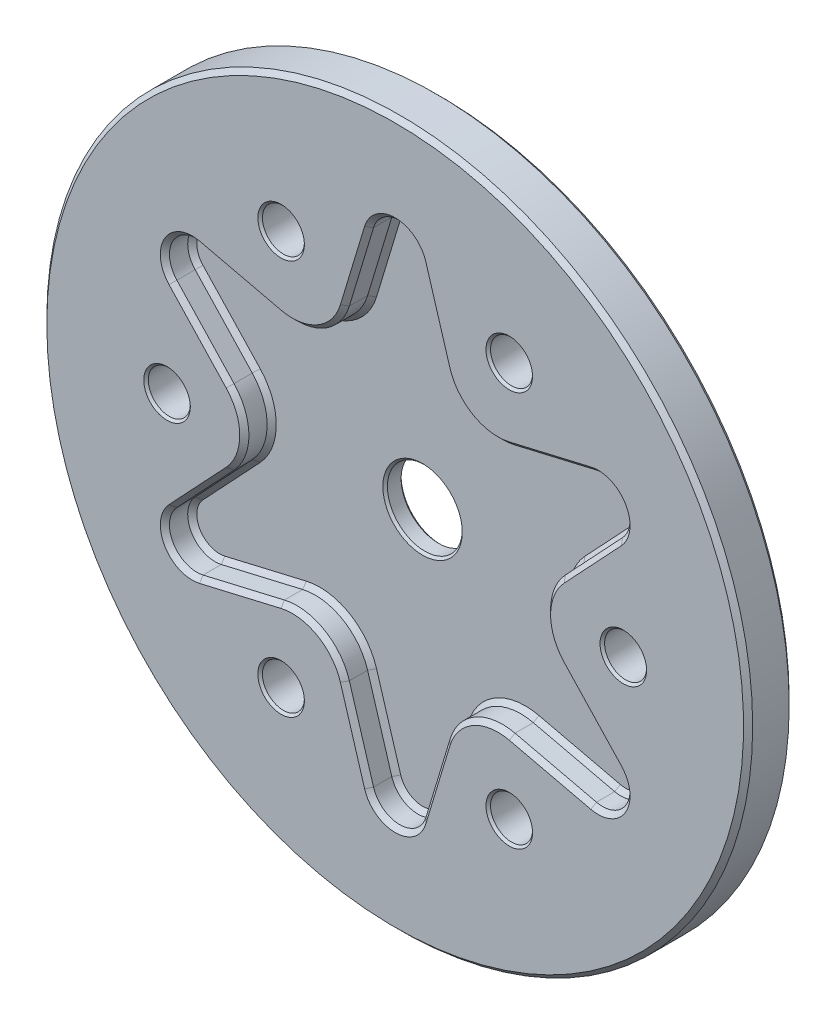
from build123d import *

# Parameters (mm, degrees)
SKETCH1_W           = 38.675
SKETCH1_H           = 5
SKETCH3_R           = 4.1
SKETCH3_R_2         = 2.3
CUT_EXTRUDE4_DEPTH  = 55.92277533
CHAMFER1_SIZE       = 0.5
CUT_EXTRUDE11_DEPTH = 3
CHAMFER2_SIZE       = 0.5
CHAMFER3_SIZE       = 0.25


with BuildPart() as part:
    # Sketch1 → Revolve1 (revolve)
    with BuildSketch(Plane(origin=(0, 0, 0), x_dir=(1, 0, 0), z_dir=(0, 1, 0)), mode=Mode.PRIVATE) as revolve1_sk:
        with Locations((-19.3375, 2.5)):
            Rectangle(SKETCH1_W, SKETCH1_H)
    revolve(revolve1_sk.sketch.rotate(Axis((0, 0, 0), (0, 0, -1)), 180), axis=Axis((0, 0, 0), (0, 0, -1)))

    # Sketch3 → Cut-Extrude4 (cut, through all)
    with BuildSketch(Plane(origin=(0, 0, 0), x_dir=(-1, 0, 0), z_dir=(0, 0, -1))):
        Circle(SKETCH3_R)
        with Locations((-12.5, 21.650635095)):
            Circle(SKETCH3_R_2)
        with Locations((12.5, 21.650635095)):
            Circle(SKETCH3_R_2)
        with Locations((25, 0)):
            Circle(SKETCH3_R_2)
        with Locations((12.5, -21.650635095)):
            Circle(SKETCH3_R_2)
        with Locations((-12.5, -21.650635095)):
            Circle(SKETCH3_R_2)
        with Locations((-25, 0)):
            Circle(SKETCH3_R_2)
    extrude(amount=CUT_EXTRUDE4_DEPTH, mode=Mode.SUBTRACT)

    # Chamfer1
    chamfer1_edges = [part.edges().sort_by_distance(p)[0] for p in [
        (-38.675, 0, 0),
        (-38.675, 0, -5),
    ]]
    chamfer(chamfer1_edges, length=CHAMFER1_SIZE)

    # Sketch14 → Cut-Extrude11 (cut)
    with BuildSketch(Plane.XY):
        with BuildLine():
            Line((-2.871572225, 26.543373742), (-5.522750274, 17.77635457))
            ThreePointArc((-5.522750274, 17.77635457), (-6.564563598, 15.785168894), (-8.265894724, 14.316949631))
            ThreePointArc((-8.265894724, 14.316949631), (-10.388075466, 13.577663288), (-12.633399507, 13.67101932))
            Line((-12.633399507, 13.67101932), (-21.55144985, 15.758541367))
            ThreePointArc((-21.55144985, 15.758541367), (-24.833278454, 14.3375), (-24.423022075, 10.784832375))
            Line((-24.423022075, 10.784832375), (-18.156149781, 4.105335249))
            ThreePointArc((-18.156149781, 4.105335249), (-16.952639064, 2.207505606), (-16.531789447, 0))
            ThreePointArc((-16.531789447, 0), (-16.952639064, -2.207505606), (-18.156149781, -4.105335249))
            Line((-18.156149781, -4.105335249), (-24.423022075, -10.784832375))
            ThreePointArc((-24.423022075, -10.784832375), (-24.833278454, -14.3375), (-21.55144985, -15.758541367))
            Line((-21.55144985, -15.758541367), (-12.633399507, -13.67101932))
            ThreePointArc((-12.633399507, -13.67101932), (-10.388075466, -13.577663288), (-8.265894724, -14.316949631))
            ThreePointArc((-8.265894724, -14.316949631), (-6.564563598, -15.785168894), (-5.522750274, -17.77635457))
            Line((-5.522750274, -17.77635457), (-2.871572225, -26.543373742))
            ThreePointArc((-2.871572225, -26.543373742), (0, -28.675), (2.871572225, -26.543373742))
            Line((2.871572225, -26.543373742), (5.522750274, -17.77635457))
            ThreePointArc((5.522750274, -17.77635457), (6.564563598, -15.785168894), (8.265894724, -14.316949631))
            ThreePointArc((8.265894724, -14.316949631), (10.388075466, -13.577663288), (12.633399507, -13.67101932))
            Line((12.633399507, -13.67101932), (21.55144985, -15.758541367))
            ThreePointArc((21.55144985, -15.758541367), (24.833278454, -14.3375), (24.423022075, -10.784832375))
            Line((24.423022075, -10.784832375), (18.156149781, -4.105335249))
            ThreePointArc((18.156149781, -4.105335249), (16.952639064, -2.207505606), (16.531789447, 0))
            ThreePointArc((16.531789447, 0), (16.952639064, 2.207505606), (18.156149781, 4.105335249))
            Line((18.156149781, 4.105335249), (24.423022075, 10.784832375))
            ThreePointArc((24.423022075, 10.784832375), (24.833278454, 14.3375), (21.55144985, 15.758541367))
            Line((21.55144985, 15.758541367), (12.633399507, 13.67101932))
            ThreePointArc((12.633399507, 13.67101932), (10.388075466, 13.577663288), (8.265894724, 14.316949631))
            ThreePointArc((8.265894724, 14.316949631), (6.564563598, 15.785168894), (5.522750274, 17.77635457))
            Line((5.522750274, 17.77635457), (2.871572225, 26.543373742))
            ThreePointArc((2.871572225, 26.543373742), (0, 28.675), (-2.871572225, 26.543373742))
        make_face()
    extrude(amount=-CUT_EXTRUDE11_DEPTH, mode=Mode.SUBTRACT)

    # Chamfer2
    chamfer2_edges = [part.edges().sort_by_distance(p)[0] for p in [
        (0, 28.675, -3),
        (4.197161249, 22.159864156, -3),
        (8.265894724, 14.316949631, -3),
        (17.092424679, 14.714780344, -3),
        (24.833278454, 14.3375, -3),
        (21.289585928, 7.445083812, -3),
        (16.531789447, 0, -3),
        (21.289585928, -7.445083812, -3),
        (24.833278454, -14.3375, -3),
        (17.092424679, -14.714780344, -3),
        (8.265894724, -14.316949631, -3),
        (4.197161249, -22.159864156, -3),
        (0, -28.675, -3),
        (-4.197161249, -22.159864156, -3),
        (-8.265894724, -14.316949631, -3),
        (-17.092424679, -14.714780344, -3),
        (-24.833278454, -14.3375, -3),
        (-21.289585928, -7.445083812, -3),
        (-16.531789447, 0, -3),
        (-21.289585928, 7.445083812, -3),
        (-24.833278454, 14.3375, -3),
        (-17.092424679, 14.714780344, -3),
        (-8.265894724, 14.316949631, -3),
        (-4.197161249, 22.159864156, -3),
        (0, 28.675, 0),
        (-4.197161249, 22.159864156, 0),
        (-8.265894724, 14.316949631, 0),
        (-17.092424679, 14.714780344, 0),
        (-24.833278454, 14.3375, 0),
        (-21.289585928, 7.445083812, 0),
        (-16.531789447, 0, 0),
        (-21.289585928, -7.445083812, 0),
        (-24.833278454, -14.3375, 0),
        (-17.092424679, -14.714780344, 0),
        (-8.265894724, -14.316949631, 0),
        (-4.197161249, -22.159864156, 0),
        (0, -28.675, 0),
        (4.197161249, -22.159864156, 0),
        (8.265894724, -14.316949631, 0),
        (17.092424679, -14.714780344, 0),
        (24.833278454, -14.3375, 0),
        (21.289585928, -7.445083812, 0),
        (16.531789447, 0, 0),
        (21.289585928, 7.445083812, 0),
        (24.833278454, 14.3375, 0),
        (17.092424679, 14.714780344, 0),
        (8.265894724, 14.316949631, 0),
        (4.197161249, 22.159864156, 0),
    ]]
    chamfer(chamfer2_edges, length=CHAMFER2_SIZE)

    # Chamfer3
    chamfer3_edges = [part.edges().sort_by_distance(p)[0] for p in [
        (14.8, 21.650635095, 0),
        (14.8, 21.650635095, -5),
        (-10.2, 21.650635095, 0),
        (-10.2, 21.650635095, -5),
        (-22.7, 0, 0),
        (-22.7, 0, -5),
        (-10.2, -21.650635095, 0),
        (-10.2, -21.650635095, -5),
        (14.8, -21.650635095, 0),
        (14.8, -21.650635095, -5),
        (27.3, 0, 0),
        (27.3, 0, -5),
        (4.1, 0, -5),
        (4.1, 0, -3),
    ]]
    chamfer(chamfer3_edges, length=CHAMFER3_SIZE)


solid = part.part
